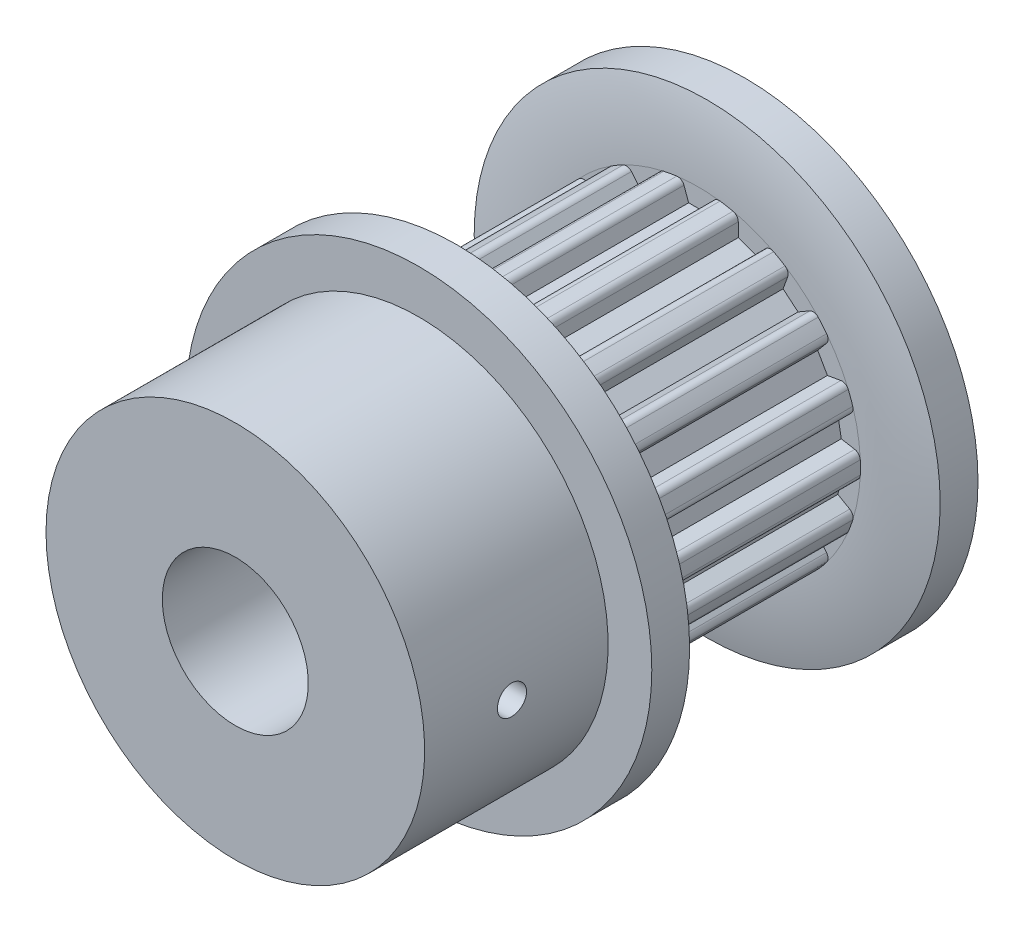
from build123d import *

# Parameters (mm, degrees)
CUT_EXTRUDE1_DEPTH            = 4
CUT_EXTRUDE1_DEPTH_BACK       = 4
F_1_0_1_DIAMETER_HOLE1_REACH  = 24.011
F_1_0_1_DIAMETER_HOLE1_BORE_R = 0.5


with BuildPart() as part:
    # Sketch8 → Revolve1 (revolve)
    with BuildSketch(Plane(origin=(0, 0, 0), x_dir=(0, 0, -1), z_dir=(1, 0, 0)), mode=Mode.PRIVATE) as revolve1_sk:
        with BuildLine():
            Line((5.6, -2.50625), (5.6, -8))
            Line((5.6, -8), (4.301619014, -8))
            ThreePointArc((4.301619014, -8), (4.075691211, -6.790545223), (4, -5.5625))
            Line((4, -5.5625), (-4, -5.5625))
            ThreePointArc((-4, -5.5625), (-4.075691211, -6.790545223), (-4.301619014, -8))
            Line((-4.301619014, -8), (-5.6, -8))
            Line((-5.6, -8), (-5.6, -6.5))
            Line((-5.6, -6.5), (-11.9, -6.5))
            Line((-11.9, -6.5), (-11.9, -2.50625))
            Line((-11.9, -2.50625), (5.6, -2.50625))
        make_face()
    revolve(revolve1_sk.sketch.rotate(Axis((0, 0, -7.597913477), (0, 0, 1)), 270), axis=Axis((0, 0, -7.597913477), (0, 0, 1)))

    # Sketch7 → Cut-Extrude1 (cut, two sides: drawn at the far end of the back side and taken through both)
    with BuildSketch(Plane.XY.offset(-CUT_EXTRUDE1_DEPTH_BACK)):
        with BuildLine():
            Line((-1.998391183, 4.511060178), (-1.368797128, 4.740213674))
            Line((-1.368797128, 4.740213674), (-1.368797128, 5.209481486))
            ThreePointArc((-1.368797128, 5.209481486), (-1.317957962, 5.353708375), (-1.187915428, 5.434175483))
            ThreePointArc((-1.187915428, 5.434175483), (-1.902487047, 5.227040203), (-2.583024657, 4.926397251))
            ThreePointArc((-2.583024657, 4.926397251), (-2.431683036, 4.948345598), (-2.300030719, 4.870540178))
            Line((-2.300030719, 4.870540178), (-1.998391183, 4.511060178))
        make_face()
        with BuildLine():
            Line((-0.335, 4.9225), (0.335, 4.9225))
            Line((0.335, 4.9225), (0.495499044, 5.3634675))
            ThreePointArc((0.495499044, 5.3634675), (0.592600734, 5.481608424), (0.742322116, 5.512745607))
            ThreePointArc((0.742322116, 5.512745607), (0, 5.5625), (-0.742322116, 5.512745607))
            ThreePointArc((-0.742322116, 5.512745607), (-0.592600734, 5.481608424), (-0.495499044, 5.3634675))
            Line((-0.495499044, 5.3634675), (-0.335, 4.9225))
        make_face()
        with BuildLine():
            Line((1.368797128, 4.740213674), (1.998391183, 4.511060178))
            Line((1.998391183, 4.511060178), (2.300030719, 4.870540178))
            ThreePointArc((2.300030719, 4.870540178), (2.431683036, 4.948345598), (2.583024657, 4.926397251))
            ThreePointArc((2.583024657, 4.926397251), (1.902487047, 5.227040203), (1.187915428, 5.434175483))
            ThreePointArc((1.187915428, 5.434175483), (1.317957962, 5.353708375), (1.368797128, 5.209481486))
            Line((1.368797128, 5.209481486), (1.368797128, 4.740213674))
        make_face()
        with BuildLine():
            Line((2.90749712, 3.98618762), (3.420746897, 3.555519922))
            Line((3.420746897, 3.555519922), (3.827144744, 3.790153828))
            ThreePointArc((3.827144744, 3.790153828), (3.977468476, 3.818239263), (4.112176303, 3.74585268))
            ThreePointArc((4.112176303, 3.74585268), (3.575506079, 4.261122215), (2.97487284, 4.700163597))
            ThreePointArc((2.97487284, 4.700163597), (3.069551477, 4.580072082), (3.067996165, 4.427155121))
            Line((3.067996165, 4.427155121), (2.90749712, 3.98618762))
        make_face()
        with BuildLine():
            Line((4.09551005, 2.75136851), (4.43051005, 2.17113149))
            Line((4.43051005, 2.17113149), (4.89264863, 2.25261899))
            ThreePointArc((4.89264863, 2.25261899), (5.043512516, 2.227596922), (5.145338798, 2.113502994))
            ThreePointArc((5.145338798, 2.113502994), (4.817266309, 2.78125), (4.403016682, 3.399242613))
            ThreePointArc((4.403016682, 3.399242613), (4.450911782, 3.254011502), (4.397149585, 3.11084851))
            Line((4.397149585, 3.11084851), (4.09551005, 2.75136851))
        make_face()
        with BuildLine():
            Line((4.789544025, 1.184693752), (4.905888304, 0.524872557))
            Line((4.905888304, 0.524872557), (5.368026883, 0.443385057))
            ThreePointArc((5.368026883, 0.443385057), (5.501234513, 0.368273516), (5.557897497, 0.226233654))
            ThreePointArc((5.557897497, 0.226233654), (5.477993126, 0.965917988), (5.300091731, 1.688322803))
            ThreePointArc((5.300091731, 1.688322803), (5.295426438, 1.535469111), (5.195941871, 1.419327658))
            Line((5.195941871, 1.419327658), (4.789544025, 1.184693752))
        make_face()
        with BuildLine():
            Line((4.905888304, -0.524872557), (4.789544025, -1.184693752))
            Line((4.789544025, -1.184693752), (5.195941871, -1.419327658))
            ThreePointArc((5.195941871, -1.419327658), (5.295426438, -1.535469111), (5.300091731, -1.688322803))
            ThreePointArc((5.300091731, -1.688322803), (5.477993126, -0.965917988), (5.557897497, -0.226233654))
            ThreePointArc((5.557897497, -0.226233654), (5.501234513, -0.368273516), (5.368026883, -0.443385057))
            Line((5.368026883, -0.443385057), (4.905888304, -0.524872557))
        make_face()
        with BuildLine():
            Line((4.43051005, -2.17113149), (4.09551005, -2.75136851))
            Line((4.09551005, -2.75136851), (4.397149585, -3.11084851))
            ThreePointArc((4.397149585, -3.11084851), (4.450911782, -3.254011502), (4.403016682, -3.399242613))
            ThreePointArc((4.403016682, -3.399242613), (4.817266309, -2.78125), (5.145338798, -2.113502994))
            ThreePointArc((5.145338798, -2.113502994), (5.043512516, -2.227596922), (4.89264863, -2.25261899))
            Line((4.89264863, -2.25261899), (4.43051005, -2.17113149))
        make_face()
        with BuildLine():
            Line((3.420746897, -3.555519922), (2.90749712, -3.98618762))
            Line((2.90749712, -3.98618762), (3.067996165, -4.427155121))
            ThreePointArc((3.067996165, -4.427155121), (3.069551477, -4.580072082), (2.97487284, -4.700163597))
            ThreePointArc((2.97487284, -4.700163597), (3.575506079, -4.261122215), (4.112176303, -3.74585268))
            ThreePointArc((4.112176303, -3.74585268), (3.977468476, -3.818239263), (3.827144744, -3.790153828))
            Line((3.827144744, -3.790153828), (3.420746897, -3.555519922))
        make_face()
        with BuildLine():
            Line((1.998391183, -4.511060178), (1.368797128, -4.740213674))
            Line((1.368797128, -4.740213674), (1.368797128, -5.209481486))
            ThreePointArc((1.368797128, -5.209481486), (1.317957962, -5.353708375), (1.187915428, -5.434175483))
            ThreePointArc((1.187915428, -5.434175483), (1.902487047, -5.227040203), (2.583024657, -4.926397251))
            ThreePointArc((2.583024657, -4.926397251), (2.431683036, -4.948345598), (2.300030719, -4.870540178))
            Line((2.300030719, -4.870540178), (1.998391183, -4.511060178))
        make_face()
        with BuildLine():
            Line((0.335, -4.9225), (-0.335, -4.9225))
            Line((-0.335, -4.9225), (-0.495499044, -5.3634675))
            ThreePointArc((-0.495499044, -5.3634675), (-0.592600734, -5.481608424), (-0.742322116, -5.512745607))
            ThreePointArc((-0.742322116, -5.512745607), (0, -5.5625), (0.742322116, -5.512745607))
            ThreePointArc((0.742322116, -5.512745607), (0.592600734, -5.481608424), (0.495499044, -5.3634675))
            Line((0.495499044, -5.3634675), (0.335, -4.9225))
        make_face()
        with BuildLine():
            Line((-1.368797128, -4.740213674), (-1.998391183, -4.511060178))
            Line((-1.998391183, -4.511060178), (-2.300030719, -4.870540178))
            ThreePointArc((-2.300030719, -4.870540178), (-2.431683036, -4.948345598), (-2.583024657, -4.926397251))
            ThreePointArc((-2.583024657, -4.926397251), (-1.902487047, -5.227040203), (-1.187915428, -5.434175483))
            ThreePointArc((-1.187915428, -5.434175483), (-1.317957962, -5.353708375), (-1.368797128, -5.209481486))
            Line((-1.368797128, -5.209481486), (-1.368797128, -4.740213674))
        make_face()
        with BuildLine():
            Line((-2.90749712, -3.98618762), (-3.420746897, -3.555519922))
            Line((-3.420746897, -3.555519922), (-3.827144744, -3.790153828))
            ThreePointArc((-3.827144744, -3.790153828), (-3.977468476, -3.818239263), (-4.112176303, -3.74585268))
            ThreePointArc((-4.112176303, -3.74585268), (-3.575506079, -4.261122215), (-2.97487284, -4.700163597))
            ThreePointArc((-2.97487284, -4.700163597), (-3.069551477, -4.580072082), (-3.067996165, -4.427155121))
            Line((-3.067996165, -4.427155121), (-2.90749712, -3.98618762))
        make_face()
        with BuildLine():
            Line((-4.09551005, -2.75136851), (-4.43051005, -2.17113149))
            Line((-4.43051005, -2.17113149), (-4.89264863, -2.25261899))
            ThreePointArc((-4.89264863, -2.25261899), (-5.043512516, -2.227596922), (-5.145338798, -2.113502994))
            ThreePointArc((-5.145338798, -2.113502994), (-4.817266309, -2.78125), (-4.403016682, -3.399242613))
            ThreePointArc((-4.403016682, -3.399242613), (-4.450911782, -3.254011502), (-4.397149585, -3.11084851))
            Line((-4.397149585, -3.11084851), (-4.09551005, -2.75136851))
        make_face()
        with BuildLine():
            Line((-4.789544025, -1.184693752), (-4.905888304, -0.524872557))
            Line((-4.905888304, -0.524872557), (-5.368026883, -0.443385057))
            ThreePointArc((-5.368026883, -0.443385057), (-5.501234513, -0.368273516), (-5.557897497, -0.226233654))
            ThreePointArc((-5.557897497, -0.226233654), (-5.477993126, -0.965917988), (-5.300091731, -1.688322803))
            ThreePointArc((-5.300091731, -1.688322803), (-5.295426438, -1.535469111), (-5.195941871, -1.419327658))
            Line((-5.195941871, -1.419327658), (-4.789544025, -1.184693752))
        make_face()
        with BuildLine():
            Line((-4.905888304, 0.524872557), (-4.789544025, 1.184693752))
            Line((-4.789544025, 1.184693752), (-5.195941871, 1.419327658))
            ThreePointArc((-5.195941871, 1.419327658), (-5.295426438, 1.535469111), (-5.300091731, 1.688322803))
            ThreePointArc((-5.300091731, 1.688322803), (-5.477993126, 0.965917988), (-5.557897497, 0.226233654))
            ThreePointArc((-5.557897497, 0.226233654), (-5.501234513, 0.368273516), (-5.368026883, 0.443385057))
            Line((-5.368026883, 0.443385057), (-4.905888304, 0.524872557))
        make_face()
        with BuildLine():
            Line((-4.43051005, 2.17113149), (-4.09551005, 2.75136851))
            Line((-4.09551005, 2.75136851), (-4.397149585, 3.11084851))
            ThreePointArc((-4.397149585, 3.11084851), (-4.450911782, 3.254011502), (-4.403016682, 3.399242613))
            ThreePointArc((-4.403016682, 3.399242613), (-4.817266309, 2.78125), (-5.145338798, 2.113502994))
            ThreePointArc((-5.145338798, 2.113502994), (-5.043512516, 2.227596922), (-4.89264863, 2.25261899))
            Line((-4.89264863, 2.25261899), (-4.43051005, 2.17113149))
        make_face()
        with BuildLine():
            Line((-3.420746897, 3.555519922), (-2.90749712, 3.98618762))
            Line((-2.90749712, 3.98618762), (-3.067996165, 4.427155121))
            ThreePointArc((-3.067996165, 4.427155121), (-3.069551477, 4.580072082), (-2.97487284, 4.700163597))
            ThreePointArc((-2.97487284, 4.700163597), (-3.575506079, 4.261122215), (-4.112176303, 3.74585268))
            ThreePointArc((-4.112176303, 3.74585268), (-3.977468476, 3.818239263), (-3.827144744, 3.790153828))
            Line((-3.827144744, 3.790153828), (-3.420746897, 3.555519922))
        make_face()
    extrude(amount=CUT_EXTRUDE1_DEPTH + CUT_EXTRUDE1_DEPTH_BACK, mode=Mode.SUBTRACT)

    # Ø1.0 (1) Diameter Hole1 bore (on position points) → Ø1.0 (1) Diameter Hole1 (cut, up to next)
    with BuildSketch(Plane(origin=(6.5, 0, 8.9), x_dir=(0, 1, 0), z_dir=(1, 0, 0)), mode=Mode.PRIVATE) as f_1_0_1_diameter_hole1_sk1:
        Circle(F_1_0_1_DIAMETER_HOLE1_BORE_R)
    f_1_0_1_diameter_hole1_tool1 = extrude(f_1_0_1_diameter_hole1_sk1.sketch, amount=-F_1_0_1_DIAMETER_HOLE1_REACH, mode=Mode.PRIVATE) & part.part
    add(f_1_0_1_diameter_hole1_tool1.solids().sort_by_distance((6.5, 0, 8.9))[0], mode=Mode.SUBTRACT)


solid = part.part
